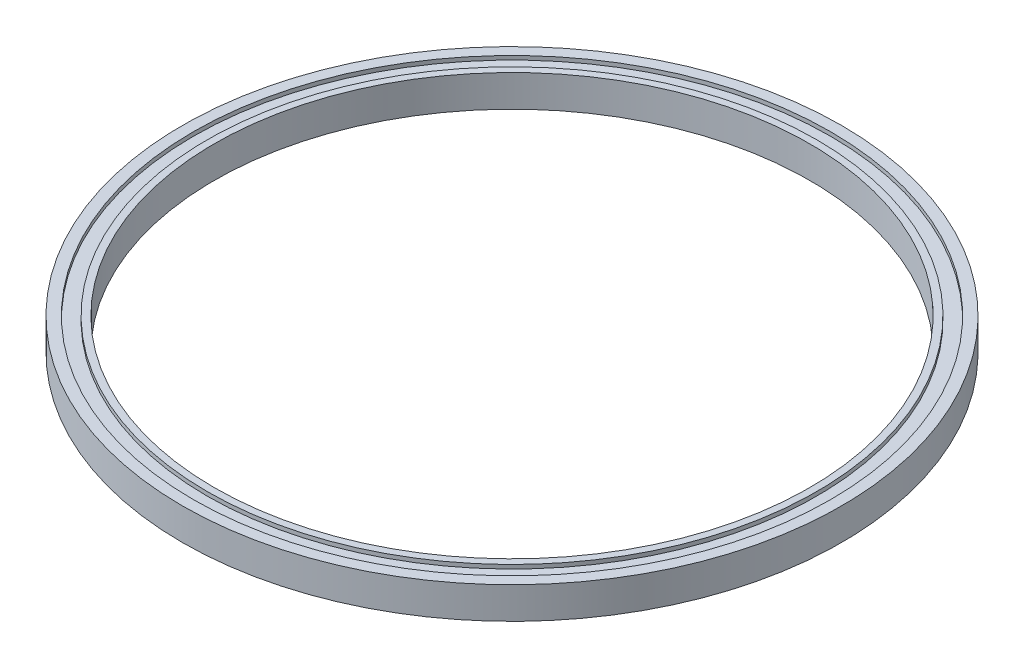
from build123d import *


with BuildPart() as part:
    # 草图1 → 旋转1 (revolve)
    with BuildSketch(Plane.XY, mode=Mode.PRIVATE) as revolve_1_sk:
        Polygon((75, 4), (76.75, 4), (76.75, 3), (80.25, 3), (80.25, 4), (83, 4), (83, -4), (80.25, -4), (80.25, -3), (76.75, -3), (76.75, -4), (75, -4), align=None)
    revolve(revolve_1_sk.sketch.rotate(Axis((0, 122.622277443, 0), (0, -1, 0)), 90), axis=Axis((0, 122.622277443, 0), (0, -1, 0)))


solid = part.part
